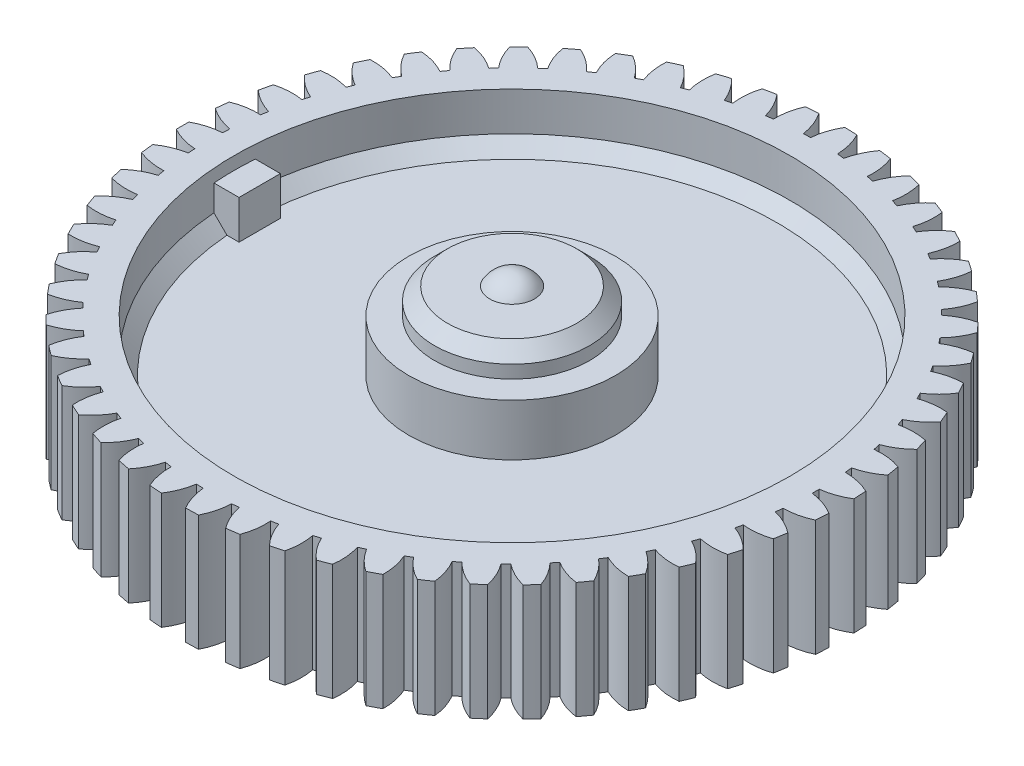
from build123d import *

# Parameters (mm, degrees)
ENL_V_MAT_EXTRU_1_DEPTH      = 41.031237802
R_P_TITION_CIRCULAIRE1_COUNT = 55
BOSS_EXTRU_1_START           = 3
BOSS_EXTRU_1_DEPTH           = 3


with BuildPart() as part:
    # Esquisse1 → Base-Révolution (revolve)
    with BuildSketch(Plane.XY):
        with BuildLine():
            Line((1.732050808, 16), (5, 16))
            Line((5, 16), (6, 15))
            Line((6, 15), (6, 14))
            Line((6, 14), (8, 14))
            Line((8, 14), (8, 10))
            Line((8, 10), (20.5, 10))
            Line((20.5, 10), (21.5, 11))
            Line((21.5, 11), (21.5, 14))
            Line((21.5, 14), (25.5, 14))
            Line((25.5, 14), (25.5, 5))
            Line((25.5, 5), (8, 5))
            Line((8, 5), (8, 0))
            Line((8, 0), (4, 0))
            Line((4, 0), (4, 14))
            Line((4, 14), (0, 14))
            Line((0, 14), (0, 17))
            ThreePointArc((0, 17), (1, 16.732050808), (1.732050808, 16))
        make_face()
    revolve(axis=Axis((0, 12.5, 0), (0, 1, 0)))

    # Esquisse2 → Enlèv. mat.-Extru.1 (cut, through all)
    with BuildSketch(Plane(origin=(-2, 14, 0), x_dir=(-1, 0, 0), z_dir=(0, 1, 0))):
        with BuildLine():
            ThreePointArc((-27.973390727, 1.318867409), (-28.008191771, 0), (-27.973390727, -1.318867409))
            ThreePointArc((-27.973390727, -1.318867409), (-26.810109528, -0.619205508), (-25.498581106, -0.26900111))
            ThreePointArc((-25.498581106, -0.26900111), (-25.500189185, 0), (-25.498581106, 0.26900111))
            ThreePointArc((-25.498581106, 0.26900111), (-26.810109528, 0.619205508), (-27.973390727, 1.318867409))
        make_face()
    enl_v_mat_extru_1 = extrude(amount=-ENL_V_MAT_EXTRU_1_DEPTH, mode=Mode.SUBTRACT)

    # Répétition circulaire1: Enlèv. mat.-Extru.1 ×55 about axis
    r_p_tition_circulaire1_axis = Axis((0, 12.5, 0), (0, 1, 0))
    for i in range(1, R_P_TITION_CIRCULAIRE1_COUNT):
        add(enl_v_mat_extru_1.rotate(r_p_tition_circulaire1_axis, i * 360 / R_P_TITION_CIRCULAIRE1_COUNT), mode=Mode.SUBTRACT)

    # Esquisse3 → Boss.-Extru.1 (add)
    with BuildSketch(Plane(origin=(0, 10, 0), x_dir=(-1, 0, 0), z_dir=(0, 1, 0)).offset(BOSS_EXTRU_1_START)):
        with BuildLine():
            Line((19.5, 1.626267422), (21.438406057, 1.626267422))
            ThreePointArc((21.438406057, 1.626267422), (21.499983828, 0.026369958), (21.442330819, -1.573673744))
            Line((21.442330819, -1.573673744), (19.5, -1.573673744))
            Line((19.5, -1.573673744), (19.5, 1.626267422))
        make_face()
    extrude(amount=-BOSS_EXTRU_1_DEPTH)


solid = part.part
